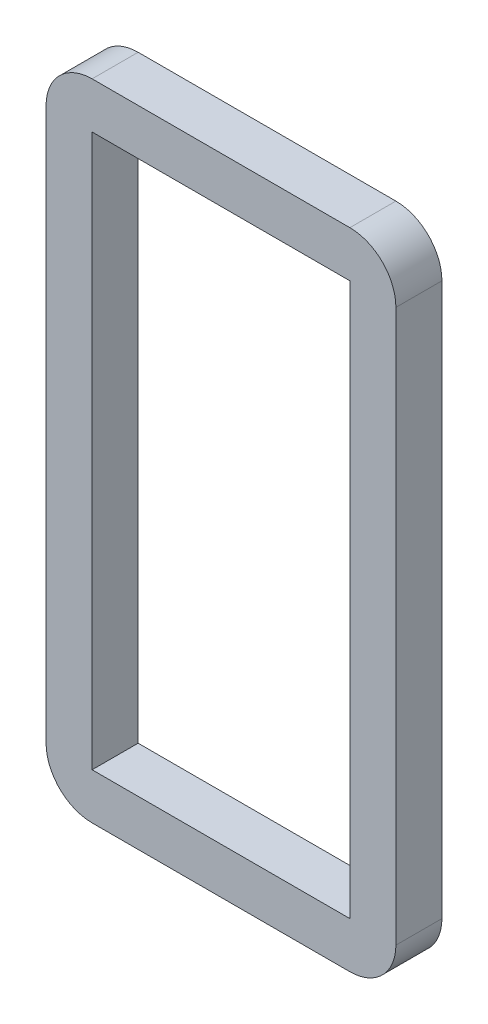
from build123d import *

# Parameters (mm, degrees)
SKETCH1_W           = 28
SKETCH1_H           = 60
BOSS_EXTRUDE1_DEPTH = 2.5


with BuildPart() as part:
    # Sketch1 → Boss-Extrude1 (new, symmetric)
    with BuildSketch(Plane.XY):
        with BuildLine():
            Line((-14, 35), (14, 35))
            ThreePointArc((14, 35), (17.535533906, 33.535533906), (19, 30))
            Line((19, 30), (19, -30))
            ThreePointArc((19, -30), (17.535533906, -33.535533906), (14, -35))
            Line((14, -35), (-14, -35))
            ThreePointArc((-14, -35), (-17.535533906, -33.535533906), (-19, -30))
            Line((-19, -30), (-19, 30))
            ThreePointArc((-19, 30), (-17.535533906, 33.535533906), (-14, 35))
        make_face()
        Rectangle(SKETCH1_W, SKETCH1_H, mode=Mode.SUBTRACT)
    extrude(amount=BOSS_EXTRUDE1_DEPTH, both=True)


solid = part.part
